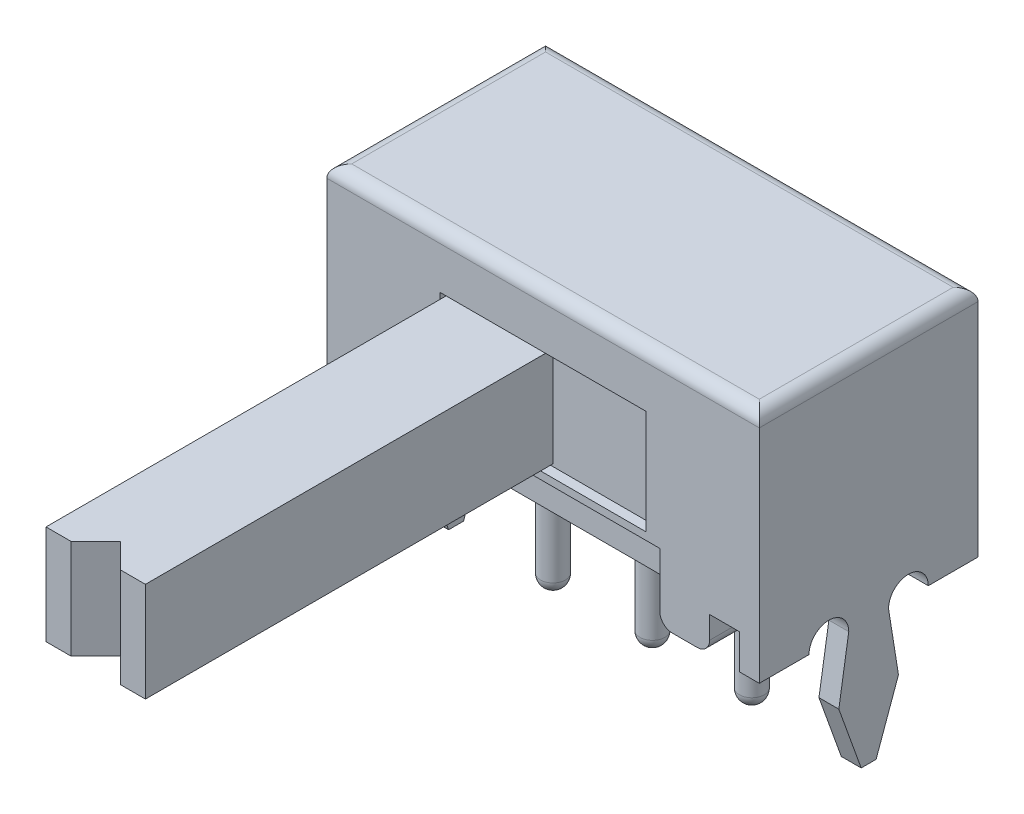
from build123d import *

# Parameters (mm, degrees)
BASE_START                 = 0.7
TOP_PROFILE_W              = 8.7
TOP_PROFILE_H              = 4.4
BASE_DEPTH                 = 4
BASE_START_2               = -2.2
BASE_EXTRUDE_DEPTH         = 4.4
BOTTOM_START               = 2.2
FRONT_PROFILE_4_W          = 4.7
FRONT_PROFILE_4_H          = 0.65
BOTTOM_FRONT_CUTOUT_DEPTH  = 0.2
BOTTOM_START_2             = -2.2
FRONT_PROFILE_5_W          = 4.7
FRONT_PROFILE_5_H          = 0.65
BOTTOM_REAR_CUTOUT_DEPTH   = 0.2
SWITCH_START               = 2.2
FRONT_PROFILE_6_W          = 4.15
FRONT_PROFILE_6_H          = 2.1
FRONT_PROFILE_6_W_2        = 2
FRONT_PROFILE_6_H_2        = 2
SWITCH_INSET_DEPTH         = 0.2
UNDERCUT_NOTCH_DEPTH       = 7.771447408
UNDERCUT_NOTCH_DEPTH_BACK  = 7.771447408
LEVER_DEPTH                = 8
LEVER_DEPTH_BACK           = 2.2
LEVER_START                = 2.2
FRONT_PROFILE_7_W          = 2
FRONT_PROFILE_7_H          = 2
RIGHT_START                = 3.95
RIGHT_PIN_DEPTH            = 0.4
LEFT_START                 = -4.35
LEFT_PIN_DEPTH             = 0.4
ELECTRICAL_PINS_DEPTH      = 4.7
ELECTRICAL_PINS_DEPTH_BACK = 2.6
PINS_R                     = 0.25
LEVER_NOTCH_DEPTH          = 13.043774325
LEVER_NOTCH_DEPTH_BACK     = 13.043774325
TOP_FILLET_R               = 0.25
PIN_FILLET_R               = 0.25


with BuildPart() as part:
    # Top Profile → Base (new body)
    with BuildSketch(Plane(origin=(0, 0, 0), x_dir=(1, 0, 0), z_dir=(0, 1, 0)).offset(BASE_START)):
        Rectangle(TOP_PROFILE_W, TOP_PROFILE_H)
    extrude(amount=BASE_DEPTH)

    # Front Profile → Base Extrude (add)
    with BuildSketch(Plane.XY.offset(BASE_START_2)):
        with BuildLine():
            Line((4.35, 0.7), (4.35, 4.7))
            Line((4.35, 4.7), (-4.35, 4.7))
            Line((-4.35, 4.7), (-4.35, 0.7))
            Line((-4.35, 0.7), (-3.35, 0.7))
            Line((-3.35, 0.7), (-3.35, 0.25))
            ThreePointArc((-3.35, 0.25), (-3.276776695, 0.073223305), (-3.1, 0))
            Line((-3.1, 0), (-2.6, 0))
            ThreePointArc((-2.6, 0), (-2.423223305, 0.073223305), (-2.35, 0.25))
            Line((-2.35, 0.25), (-2.35, 0.7))
            Line((-2.35, 0.7), (-2.35, 1.35))
            Line((-2.35, 1.35), (2.35, 1.35))
            Line((2.35, 1.35), (2.35, 0.7))
            Line((2.35, 0.7), (2.35, 0.25))
            ThreePointArc((2.35, 0.25), (2.423223305, 0.073223305), (2.6, 0))
            Line((2.6, 0), (3.1, 0))
            ThreePointArc((3.1, 0), (3.276776695, 0.073223305), (3.35, 0.25))
            Line((3.35, 0.25), (3.35, 0.7))
            Line((3.35, 0.7), (4.35, 0.7))
        make_face()
    extrude(amount=BASE_EXTRUDE_DEPTH)

    # Front Profile<4> → Bottom Front Cutout (cut)
    with BuildSketch(Plane.XY.offset(BOTTOM_START)):
        with Locations((0, 1.025)):
            Rectangle(FRONT_PROFILE_4_W, FRONT_PROFILE_4_H)
    extrude(amount=-BOTTOM_FRONT_CUTOUT_DEPTH, mode=Mode.SUBTRACT)

    # Front Profile<5> → Bottom Rear Cutout (cut)
    with BuildSketch(Plane.XY.offset(BOTTOM_START_2)):
        with Locations((0, 1.025)):
            Rectangle(FRONT_PROFILE_5_W, FRONT_PROFILE_5_H)
    extrude(amount=BOTTOM_REAR_CUTOUT_DEPTH, mode=Mode.SUBTRACT)

    # Front Profile<6> → Switch Inset (cut)
    # profile 1 of 2: a face of its own
    with BuildSketch(Plane.XY.offset(SWITCH_START)):
        with Locations((0, 2.55)):
            Rectangle(FRONT_PROFILE_6_W, FRONT_PROFILE_6_H)
        with Locations((-1, 2.55)):
            Rectangle(FRONT_PROFILE_6_W_2, FRONT_PROFILE_6_H_2, mode=Mode.SUBTRACT)
    # profile 2 of 2: a face of its own
    with BuildSketch(Plane.XY.offset(SWITCH_START)):
        with Locations((-1, 2.55)):
            Rectangle(FRONT_PROFILE_6_W_2, FRONT_PROFILE_6_H_2)
    extrude(amount=-SWITCH_INSET_DEPTH, mode=Mode.SUBTRACT)

    # Side Profile → Undercut Notch (cut, two sides: drawn at the far end of the back side and taken through both)
    with BuildSketch(Plane(origin=(0, 0, 0), x_dir=(0, 0, -1), z_dir=(1, 0, 0)).offset(-UNDERCUT_NOTCH_DEPTH_BACK)):
        with BuildLine():
            ThreePointArc((-1.2, 0), (-0.8, 0.4), (-0.4, 0))
            Line((-0.4, 0), (-1.2, 0))
        make_face()
        with BuildLine():
            ThreePointArc((0.4, 0), (0.8, 0.4), (1.2, 0))
            Line((1.2, 0), (0.4, 0))
        make_face()
        with BuildLine():
            ThreePointArc((-0.8, 0.4), (-0.517157288, 0.282842712), (-0.4, 0))
            Line((-0.4, 0), (0.4, 0))
            ThreePointArc((0.4, 0), (0.517157288, 0.282842712), (0.8, 0.4))
            Line((0.8, 0.4), (-0.8, 0.4))
        make_face()
    extrude(amount=UNDERCUT_NOTCH_DEPTH + UNDERCUT_NOTCH_DEPTH_BACK, mode=Mode.SUBTRACT)

    # Front Profile<7> → Lever (add, two sides: drawn at the far end of the back side and taken through both)
    with BuildSketch(Plane.XY.offset(LEVER_START - LEVER_DEPTH_BACK)):
        with Locations((-1, 2.55)):
            Rectangle(FRONT_PROFILE_7_W, FRONT_PROFILE_7_H)
    extrude(amount=LEVER_DEPTH + LEVER_DEPTH_BACK)

    # Side Profile<5> → Right Pin (add)
    with BuildSketch(Plane(origin=(0, 0, 0), x_dir=(0, 0, -1), z_dir=(1, 0, 0)).offset(RIGHT_START)):
        Polygon((-0.4, 0), (0.4, 0), (0.6, -1.25), (0.15, -2.5), (-0.15, -2.5), (-0.6, -1.25), align=None)
        with BuildLine():
            ThreePointArc((-0.8, 0.4), (-0.517157288, 0.282842712), (-0.4, 0))
            Line((-0.4, 0), (0.4, 0))
            ThreePointArc((0.4, 0), (0.517157288, 0.282842712), (0.8, 0.4))
            Line((0.8, 0.4), (-0.8, 0.4))
        make_face()
        with BuildLine():
            Line((2.2, 4.7), (-2.2, 4.7))
            Line((-2.2, 4.7), (-2.2, 0.7))
            Line((-2.2, 0.7), (-2.2, 0))
            Line((-2.2, 0), (-1.2, 0))
            ThreePointArc((-1.2, 0), (-1.082842712, 0.282842712), (-0.8, 0.4))
            Line((-0.8, 0.4), (0.8, 0.4))
            ThreePointArc((0.8, 0.4), (1.082842712, 0.282842712), (1.2, 0))
            Line((1.2, 0), (2.2, 0))
            Line((2.2, 0), (2.2, 0.7))
            Line((2.2, 0.7), (2.2, 4.7))
        make_face()
    extrude(amount=RIGHT_PIN_DEPTH)

    # Side Profile<6> → Left Pin (add)
    with BuildSketch(Plane(origin=(0, 0, 0), x_dir=(0, 0, -1), z_dir=(1, 0, 0)).offset(LEFT_START)):
        Polygon((-0.4, 0), (0.4, 0), (0.6, -1.25), (0.15, -2.5), (-0.15, -2.5), (-0.6, -1.25), align=None)
        with BuildLine():
            ThreePointArc((-0.8, 0.4), (-0.517157288, 0.282842712), (-0.4, 0))
            Line((-0.4, 0), (0.4, 0))
            ThreePointArc((0.4, 0), (0.517157288, 0.282842712), (0.8, 0.4))
            Line((0.8, 0.4), (-0.8, 0.4))
        make_face()
        with BuildLine():
            Line((2.2, 4.7), (-2.2, 4.7))
            Line((-2.2, 4.7), (-2.2, 0.7))
            Line((-2.2, 0.7), (-2.2, 0))
            Line((-2.2, 0), (-1.2, 0))
            ThreePointArc((-1.2, 0), (-1.082842712, 0.282842712), (-0.8, 0.4))
            Line((-0.8, 0.4), (0.8, 0.4))
            ThreePointArc((0.8, 0.4), (1.082842712, 0.282842712), (1.2, 0))
            Line((1.2, 0), (2.2, 0))
            Line((2.2, 0), (2.2, 0.7))
            Line((2.2, 0.7), (2.2, 4.7))
        make_face()
    extrude(amount=LEFT_PIN_DEPTH)

    # Pins → Electrical Pins (add, two sides: drawn at the far end of the back side and taken through both)
    with BuildSketch(Plane(origin=(0, 0, 0), x_dir=(1, 0, 0), z_dir=(0, 1, 0)).offset(-ELECTRICAL_PINS_DEPTH_BACK)):
        with Locations(Location((-2, 0, 0), (0, 0, 270))):
            Circle(PINS_R)
        with Locations(Location((0, 0, 0), (0, 0, 270))):
            Circle(PINS_R)
        with Locations(Location((2, 0, 0), (0, 0, 270))):
            Circle(PINS_R)
    extrude(amount=ELECTRICAL_PINS_DEPTH + ELECTRICAL_PINS_DEPTH_BACK)

    # Lever Notch Profile → Lever Notch (cut, two sides: drawn at the far end of the back side and taken through both)
    with BuildSketch(Plane(origin=(0, 0, 0), x_dir=(1, 0, 0), z_dir=(0, 1, 0)).offset(-LEVER_NOTCH_DEPTH_BACK)):
        Polygon((-1.5, -10.2), (-0.5, -10.2), (-1, -9.7), align=None)
    extrude(amount=LEVER_NOTCH_DEPTH + LEVER_NOTCH_DEPTH_BACK, mode=Mode.SUBTRACT)

    # Top Fillet
    top_fillet_edges = [part.edges().sort_by_distance(p)[0] for p in [
        (0, 4.7, 2.2),
        (4.35, 4.7, 0),
        (0, 4.7, -2.2),
        (-4.35, 4.7, 0),
    ]]
    fillet(top_fillet_edges, radius=TOP_FILLET_R)

    # Pin Fillet
    pin_fillet_edges = [part.edges().sort_by_distance(p)[0] for p in [
        (-2, -2.6, -0.25),
        (0, -2.6, -0.25),
        (2, -2.6, -0.25),
    ]]
    fillet(pin_fillet_edges, radius=PIN_FILLET_R)


solid = part.part
